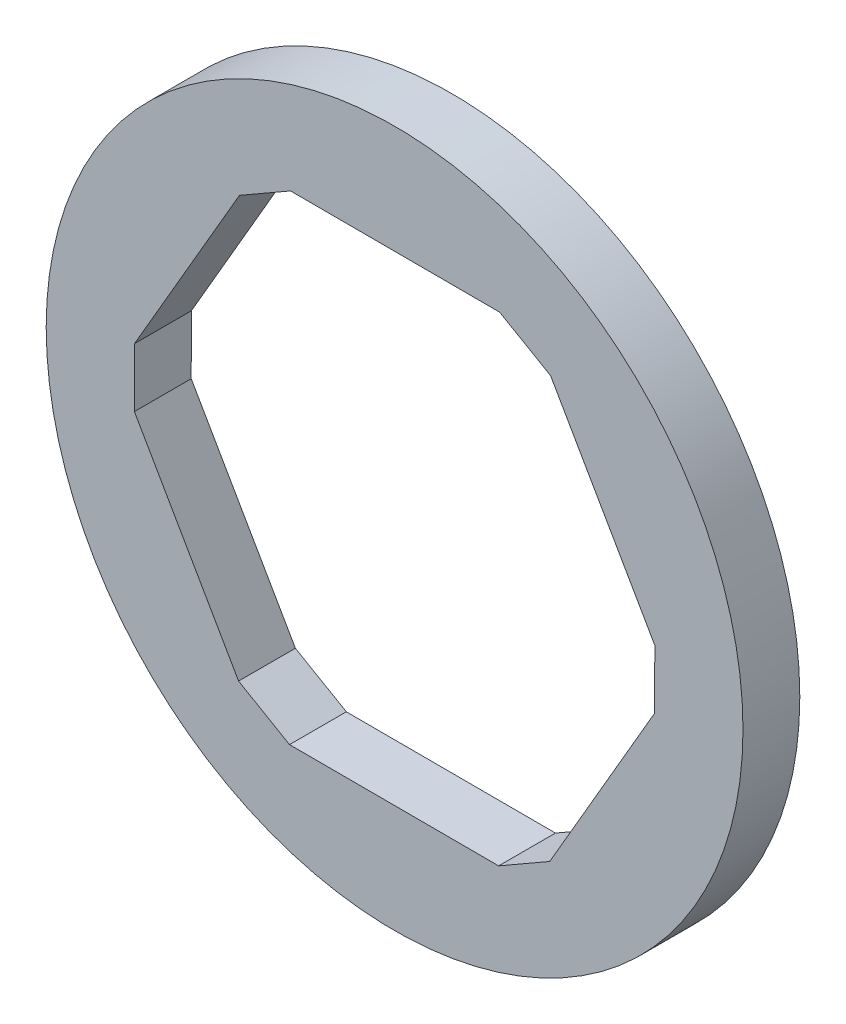
from build123d import *

# Parameters (mm, degrees)
SKETCH1_R           = 9.266757501
BOSS_EXTRUDE1_DEPTH = 1.5113


with BuildPart() as part:
    # Sketch1 → Boss-Extrude1 (new body)
    with BuildSketch(Plane.XY):
        Circle(SKETCH1_R)
        Polygon((-2.767409235, 6.38944281), (-4.125640066, 5.60915567), (-6.917124407, 0.798074705), (-6.920491338, -0.768331269), (-4.149715172, -5.591368105), (-2.794851271, -6.377486939), (2.767409235, -6.38944281), (4.125640066, -5.60915567), (6.917124407, -0.798074705), (6.920491338, 0.768331269), (4.149715172, 5.591368105), (2.794851271, 6.377486939), align=None, mode=Mode.SUBTRACT)
    extrude(amount=BOSS_EXTRUDE1_DEPTH)


solid = part.part
